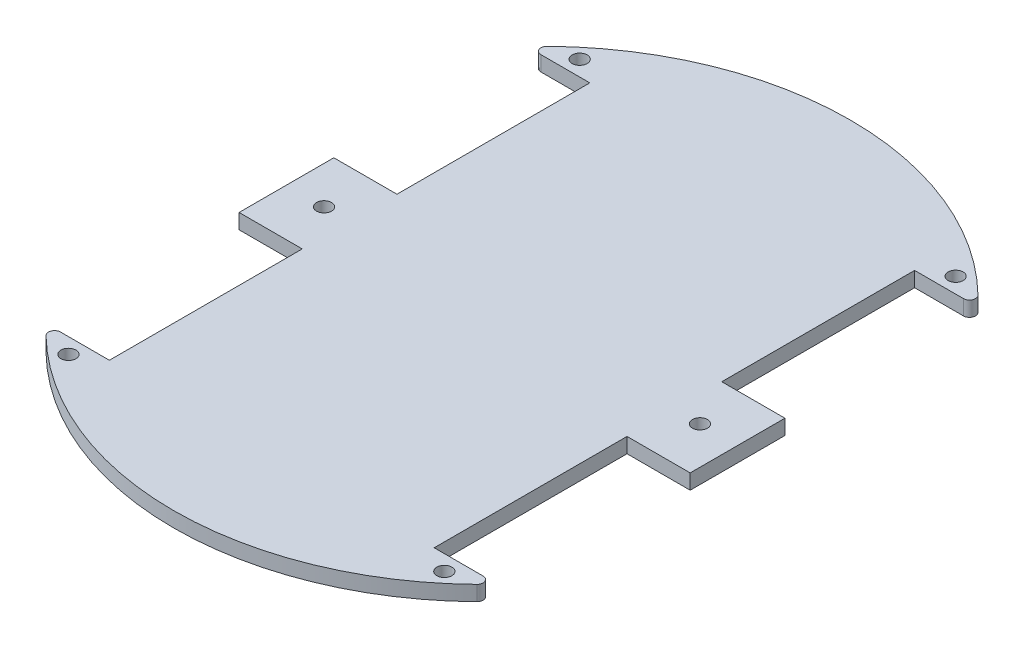
from build123d import *

# Parameters (mm, degrees)
BOSS_EXTRUDE1_DEPTH = 5
SKETCH2_R           = 2.5
CUT_EXTRUDE1_DEPTH  = 136.300591277


with BuildPart() as part:
    # Sketch1 → Boss-Extrude1 (new body)
    with BuildSketch(Plane(origin=(0, 0, 0), x_dir=(1, 0, 0), z_dir=(0, 1, 0))):
        with BuildLine():
            Line((-75, 15.75), (-75, -15.75))
            Line((-75, -15.75), (-54, -15.75))
            Line((-54, -15.75), (-54, -79.875))
            Line((-54, -79.875), (-70.25200942, -79.875))
            ThreePointArc((-70.25200942, -79.875), (-72.104159031, -81.120320055), (-71.649789587, -83.305458181))
            ThreePointArc((-71.649789587, -83.305458181), (0, -112.5), (71.649789587, -83.305458181))
            ThreePointArc((71.649789587, -83.305458181), (72.104159031, -81.120320055), (70.25200942, -79.875))
            Line((70.25200942, -79.875), (54, -79.875))
            Line((54, -79.875), (54, -15.75))
            Line((54, -15.75), (75, -15.75))
            Line((75, -15.75), (75, 0))
            Line((75, 0), (75, 15.75))
            Line((75, 15.75), (54, 15.75))
            Line((54, 15.75), (54, 79.875))
            Line((54, 79.875), (70.25200942, 79.875))
            ThreePointArc((70.25200942, 79.875), (72.104159031, 81.120320055), (71.649789587, 83.305458181))
            ThreePointArc((71.649789587, 83.305458181), (0, 112.5), (-71.649789587, 83.305458181))
            ThreePointArc((-71.649789587, 83.305458181), (-72.104159031, 81.120320055), (-70.25200942, 79.875))
            Line((-70.25200942, 79.875), (-54, 79.875))
            Line((-54, 79.875), (-54, 15.75))
            Line((-54, 15.75), (-75, 15.75))
        make_face()
    extrude(amount=BOSS_EXTRUDE1_DEPTH)

    # Sketch2 → Cut-Extrude1 (cut, through all)
    with BuildSketch(Plane(origin=(0, 5, 0), x_dir=(1, 0, 0), z_dir=(0, 1, 0))):
        with Locations(Location((-62.5, 85, 0), (0, 0, 270))):
            Circle(SKETCH2_R)
        with Locations(Location((62.5, 85, 0), (0, 0, 270))):
            Circle(SKETCH2_R)
        with Locations(Location((62.5, 0, 0), (0, 0, 270))):
            Circle(SKETCH2_R)
        with Locations(Location((62.5, -85, 0), (0, 0, 270))):
            Circle(SKETCH2_R)
        with Locations(Location((-62.5, 0, 0), (0, 0, 270))):
            Circle(SKETCH2_R)
        with Locations(Location((-62.5, -85, 0), (0, 0, 270))):
            Circle(SKETCH2_R)
    extrude(amount=-CUT_EXTRUDE1_DEPTH, mode=Mode.SUBTRACT)


solid = part.part
